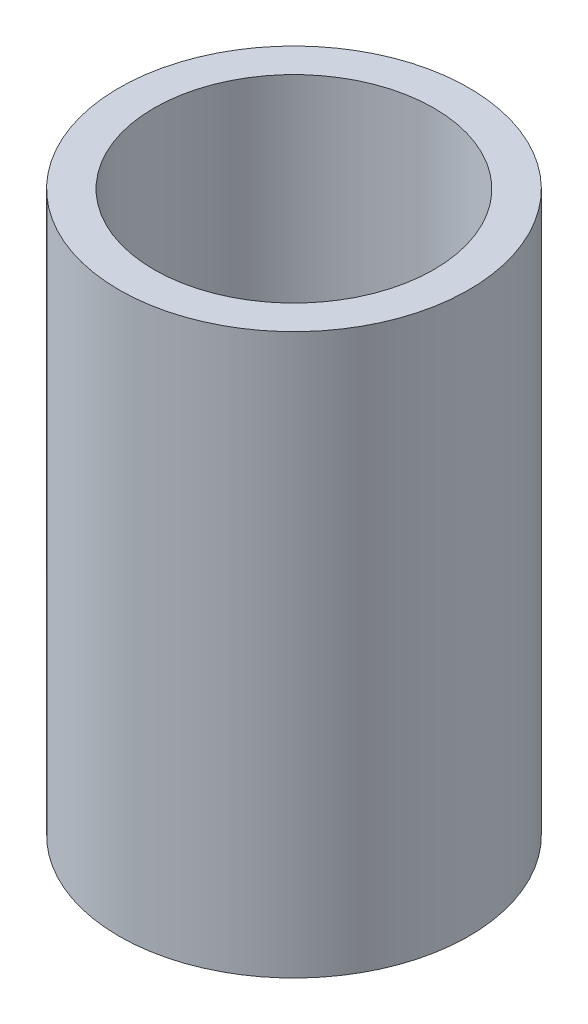
from build123d import *

# Parameters (mm, degrees)
SKETCH1_R           = 7.5
SKETCH1_R_2         = 6
BOSS_EXTRUDE1_DEPTH = 24


with BuildPart() as part:
    # Sketch1 → Boss-Extrude1 (new body)
    with BuildSketch(Plane(origin=(0, 0, 0), x_dir=(1, 0, 0), z_dir=(0, 1, 0))):
        with Locations(Location((0, 0, 0), (0, 0, 270))):
            Circle(SKETCH1_R)
        with Locations(Location((0, 0, 0), (0, 0, 270))):
            Circle(SKETCH1_R_2, mode=Mode.SUBTRACT)
    extrude(amount=BOSS_EXTRUDE1_DEPTH)


solid = part.part
